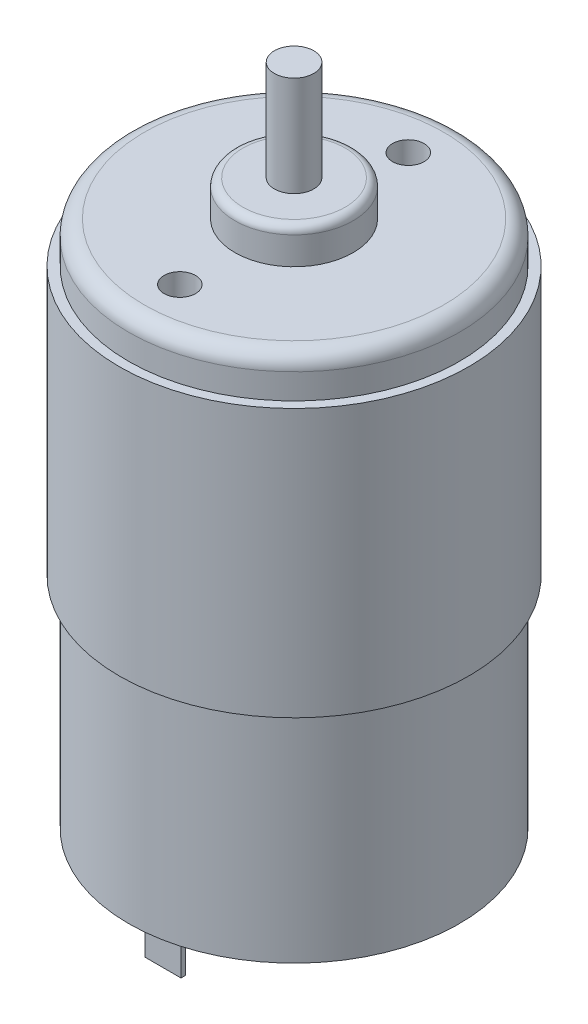
from build123d import *

# Parameters (mm, degrees)
SKETCH_1_R          = 21
EXTRUDE_1_DEPTH     = 67
SKETCH_3_R          = 7.5
EXTRUDE_3_DEPTH     = 4.5
SKETCH_4_R          = 2.5
EXTRUDE_4_DEPTH     = 12.7
FILLET_1_R          = 2
FILLET_2_R          = 1
SKETCH_15_R         = 2
CUT_EXTRUDE_2_DEPTH = 5
SKETCH_18_W         = 4.6
SKETCH_18_H         = 0.6
EXTRUDE_11_DEPTH    = 7
SKETCH_19_R         = 7.6
EXTRUDE_12_DEPTH    = 7
EXTRUDE_START       = -39.2
SKETCH_20_R         = 22.175
SKETCH_20_R_2       = 21
EXTRUDE_13_DEPTH    = 34


with BuildPart() as part:
    # 스케치1 → 보스-돌출1 (new body)
    with BuildSketch(Plane(origin=(0, 0, 0), x_dir=(1, 0, 0), z_dir=(0, 1, 0))):
        with Locations(Location((0, 0, 0), (0, 0, 270))):
            Circle(SKETCH_1_R)
    extrude(amount=EXTRUDE_1_DEPTH)

    # 스케치3 → 보스-돌출3 (add)
    with BuildSketch(Plane(origin=(0, 67, 0), x_dir=(1, 0, 0), z_dir=(0, 1, 0))):
        with Locations(Location((0, 0, 0), (0, 0, 270))):
            Circle(SKETCH_3_R)
    extrude(amount=EXTRUDE_3_DEPTH)

    # 스케치4 → 보스-돌출4 (add)
    with BuildSketch(Plane(origin=(0, 71.5, 0), x_dir=(1, 0, 0), z_dir=(0, 1, 0))):
        with Locations(Location((0, 0, 0), (0, 0, 270))):
            Circle(SKETCH_4_R)
    extrude(amount=EXTRUDE_4_DEPTH)

    # 필렛1
    fillet_1_edges = [part.edges().sort_by_distance(p)[0] for p in [
        (0, 67, -21),
    ]]
    fillet(fillet_1_edges, radius=FILLET_1_R)

    # 필렛2
    fillet_2_edges = [part.edges().sort_by_distance(p)[0] for p in [
        (0, 71.5, -7.5),
    ]]
    fillet(fillet_2_edges, radius=FILLET_2_R)

    # 스케치15 → 컷-돌출2 (cut)
    with BuildSketch(Plane(origin=(0, 67, 0), x_dir=(1, 0, 0), z_dir=(0, 1, 0))):
        with Locations(Location((0, 14.5, 0), (0, 0, 270))):
            Circle(SKETCH_15_R)
        with Locations(Location((0, -14.5, 0), (0, 0, 270))):
            Circle(SKETCH_15_R)
    extrude(amount=-CUT_EXTRUDE_2_DEPTH, mode=Mode.SUBTRACT)

    # 스케치18 → 보스-돌출11 (add)
    with BuildSketch(Plane.XZ):
        with Locations((0, 16.35)):
            Rectangle(SKETCH_18_W, SKETCH_18_H)
        with Locations((0, -16.35)):
            Rectangle(SKETCH_18_W, SKETCH_18_H)
    extrude(amount=EXTRUDE_11_DEPTH)

    # 스케치19 → 보스-돌출12 (add)
    with BuildSketch(Plane.XZ):
        with Locations(Location((0, 0, 0), (0, 0, 90))):
            Circle(SKETCH_19_R)
    extrude(amount=EXTRUDE_12_DEPTH)

    # 스케치20 → 보스-돌출13 (add)
    with BuildSketch(Plane(origin=(0, 67, 0), x_dir=(1, 0, 0), z_dir=(0, 1, 0)).offset(EXTRUDE_START)):
        with Locations(Location((0, 0, 0), (0, 0, 270))):
            Circle(SKETCH_20_R)
        with Locations(Location((0, 0, 0), (0, 0, 270))):
            Circle(SKETCH_20_R_2, mode=Mode.SUBTRACT)
    extrude(amount=EXTRUDE_13_DEPTH)


solid = part.part
